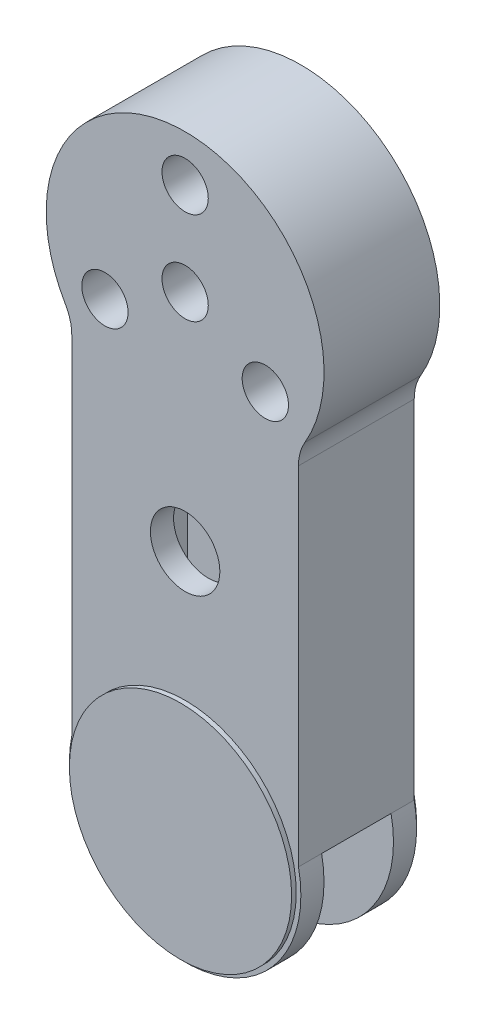
from build123d import *

# Parameters (mm, degrees)
BOSS_EXTRU_1_DEPTH      = 25
ENL_V_MAT_EXTRU_6_DEPTH = 15
ESQUISSE7_R             = 10
ENL_V_MAT_EXTRU_7_DEPTH = 263.603726785
ESQUISSE8_R             = 48
BOSS_EXTRU_2_DEPTH      = 2
BOSS_EXTRU_3_START      = 2
ESQUISSE9_R             = 48
BOSS_EXTRU_3_DEPTH      = 2
ESQUISSE11_R            = 15
ENL_V_MAT_EXTRU_8_DEPTH = 20
ESQUISSE12_R            = 10
BOSS_EXTRU_4_DEPTH      = 30


with BuildPart() as part:
    # Esquisse1 → Boss.-Extru.1 (new, symmetric)
    with BuildSketch(Plane.XY):
        with BuildLine():
            Line((48.961575437, -40.549982901), (48.961575437, -190.58313224))
            ThreePointArc((48.961575437, -190.58313224), (0, -250.7203967), (-48.961575437, -190.58313224))
            Line((-48.961575437, -190.58313224), (-48.961575437, -40.549982901))
            ThreePointArc((-48.961575437, -40.549982901), (-49.663805136, -35.296787549), (-51.721181578, -30.412487176))
            ThreePointArc((-51.721181578, -30.412487176), (0, 60), (51.721181578, -30.412487176))
            ThreePointArc((51.721181578, -30.412487176), (49.663805136, -35.296787549), (48.961575437, -40.549982901))
        make_face()
    extrude(amount=BOSS_EXTRU_1_DEPTH, both=True)

    # Esquisse6 → Enlèv. mat.-Extru.6 (cut, symmetric)
    with BuildSketch(Plane.XY):
        with BuildLine():
            Line((-48.961575437, -190.58313224), (-44.819439813, -186.440996616))
            ThreePointArc((-44.819439813, -186.440996616), (-40.483984787, -179.95252964), (-38.961575437, -172.298860992))
            Line((-38.961575437, -172.298860992), (-38.961575437, -60.549982901))
            ThreePointArc((-38.961575437, -60.549982901), (-36.032643249, -53.478915089), (-28.961575437, -50.549982901))
            Line((-28.961575437, -50.549982901), (28.961575437, -50.549982901))
            ThreePointArc((28.961575437, -50.549982901), (36.032643249, -53.478915089), (38.961575437, -60.549982901))
            Line((38.961575437, -60.549982901), (38.961575437, -172.298860992))
            ThreePointArc((38.961575437, -172.298860992), (40.483984787, -179.95252964), (44.819439813, -186.440996616))
            Line((44.819439813, -186.440996616), (48.961575437, -190.58313224))
            Line((48.961575437, -190.58313224), (84.871492003, -248.547724845))
            Line((84.871492003, -248.547724845), (0, -290.851549547))
            Line((0, -290.851549547), (-95.233900293, -248.547724845))
            Line((-95.233900293, -248.547724845), (-48.961575437, -190.58313224))
        make_face()
    extrude(amount=ENL_V_MAT_EXTRU_6_DEPTH, both=True, mode=Mode.SUBTRACT)

    # Esquisse7 → Enlèv. mat.-Extru.7 (cut, through all)
    with BuildSketch(Plane.XY.offset(25)):
        Circle(ESQUISSE7_R)
        with Locations((0, 40)):
            Circle(ESQUISSE7_R)
        with Locations((34.641016151, -20)):
            Circle(ESQUISSE7_R)
        with Locations((-34.641016151, -20)):
            Circle(ESQUISSE7_R)
    extrude(amount=-ENL_V_MAT_EXTRU_7_DEPTH, mode=Mode.SUBTRACT)

    # Esquisse8 → Boss.-Extru.2 (add)
    with BuildSketch(Plane.XY.offset(25)):
        with Locations(Location((0, -200.7203967, 0), (0, 0, 180))):
            Circle(ESQUISSE8_R)
    extrude(amount=BOSS_EXTRU_2_DEPTH)

    # Esquisse9 → Boss.-Extru.3 (add)
    with BuildSketch(Plane(origin=(0, 0, -25), x_dir=(-1, 0, 0), z_dir=(0, 0, -1)).offset(BOSS_EXTRU_3_START)):
        with Locations((0, -200.7203967)):
            Circle(ESQUISSE9_R)
    extrude(amount=-BOSS_EXTRU_3_DEPTH)

    # Esquisse11 → Enlèv. mat.-Extru.8 (cut)
    with BuildSketch(Plane.XY.offset(25)):
        with Locations((0, -97.061157092)):
            Circle(ESQUISSE11_R)
    extrude(amount=-ENL_V_MAT_EXTRU_8_DEPTH, mode=Mode.SUBTRACT)

    # Esquisse12 → Boss.-Extru.4 (add)
    with BuildSketch(Plane.XY.offset(-15)):
        with Locations(Location((0, -200.7203967, 0), (0, 0, 180))):
            Circle(ESQUISSE12_R)
    extrude(amount=BOSS_EXTRU_4_DEPTH)


solid = part.part
